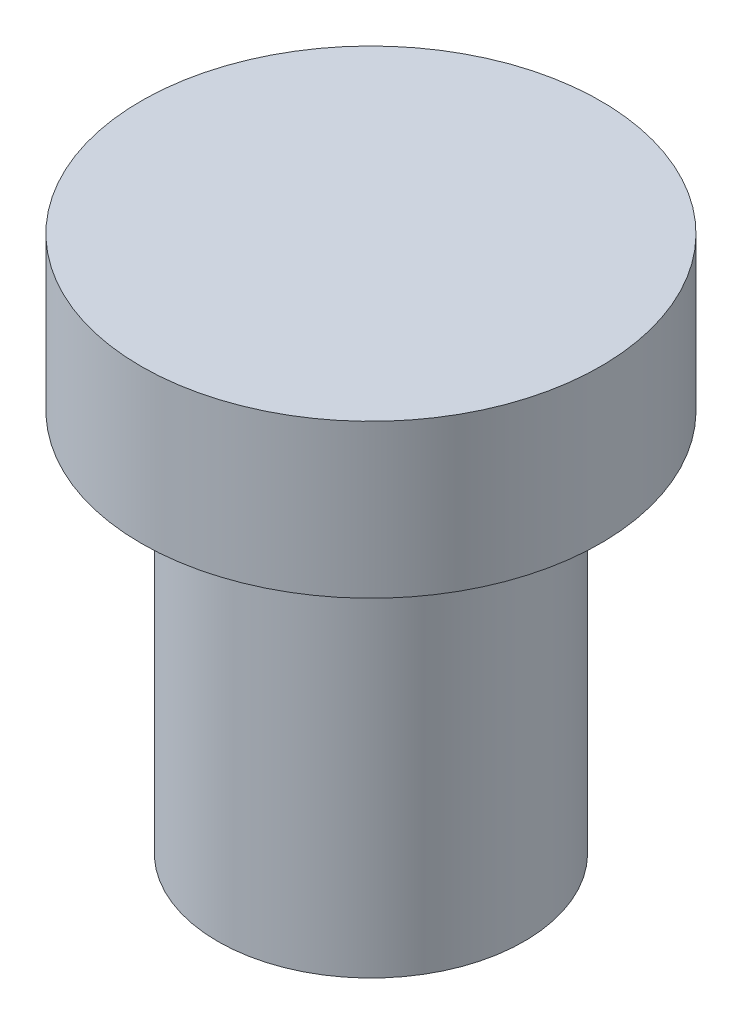
from build123d import *


with BuildPart() as part:
    # 스케치1 → 회전1 (revolve)
    with BuildSketch(Plane(origin=(0, 0, 0), x_dir=(0, 0, -1), z_dir=(1, 0, 0)), mode=Mode.PRIVATE) as revolve_1_sk:
        Polygon((0, 16.246180973), (3, 16.246180973), (3, 14.246180973), (2, 14.246180973), (2, 9.246180973), (0, 9.246180973), align=None)
    revolve(revolve_1_sk.sketch.rotate(Axis((0, 20.990482646, 0), (0, -1, 0)), 180), axis=Axis((0, 20.990482646, 0), (0, -1, 0)))


solid = part.part
